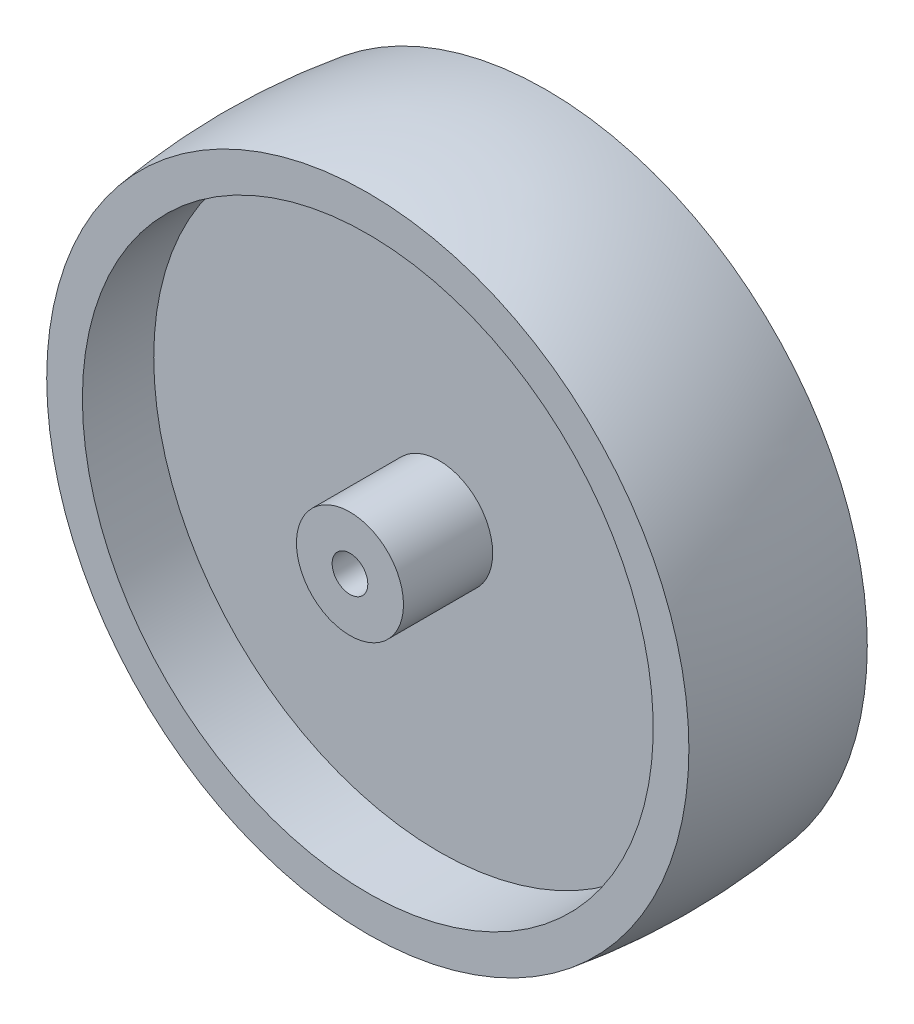
from build123d import *

# Parameters (mm, degrees)
SCHIZZO1_R                   = 15
SCHIZZO1_R_2                 = 5
ESTRUSIONE_ESTRUSIONE1_DEPTH = 60
SCHIZZO2_R                   = 80
SCHIZZO2_R_2                 = 15
ESTRUSIONE_ESTRUSIONE2_DEPTH = 5


with BuildPart() as part:
    # Schizzo1 → Estrusione-Estrusione1 (new body)
    with BuildSketch(Plane.XY):
        Circle(SCHIZZO1_R)
        Circle(SCHIZZO1_R_2, mode=Mode.SUBTRACT)
    extrude(amount=ESTRUSIONE_ESTRUSIONE1_DEPTH)

    # Schizzo2 → Estrusione-Estrusione2 (add, symmetric)
    with BuildSketch(Plane.XY.offset(30)):
        Circle(SCHIZZO2_R)
        Circle(SCHIZZO2_R_2, mode=Mode.SUBTRACT)
    extrude(amount=ESTRUSIONE_ESTRUSIONE2_DEPTH, both=True)

    # Schizzo3 → Rivoluzione1 (revolve)
    with BuildSketch(Plane(origin=(0, 0, 0), x_dir=(0, 0, -1), z_dir=(1, 0, 0)), mode=Mode.PRIVATE) as rivoluzione1_sk:
        with BuildLine():
            Line((-5, 80), (-55, 80))
            Line((-55, 80), (-55, 90))
            ThreePointArc((-55, 90), (-30, 91.7445653), (-5, 90))
            Line((-5, 90), (-5, 80))
        make_face()
    revolve(rivoluzione1_sk.sketch.rotate(Axis((0, 0, 0), (0, 0, 1)), 90), axis=Axis((0, 0, 0), (0, 0, 1)))


solid = part.part
